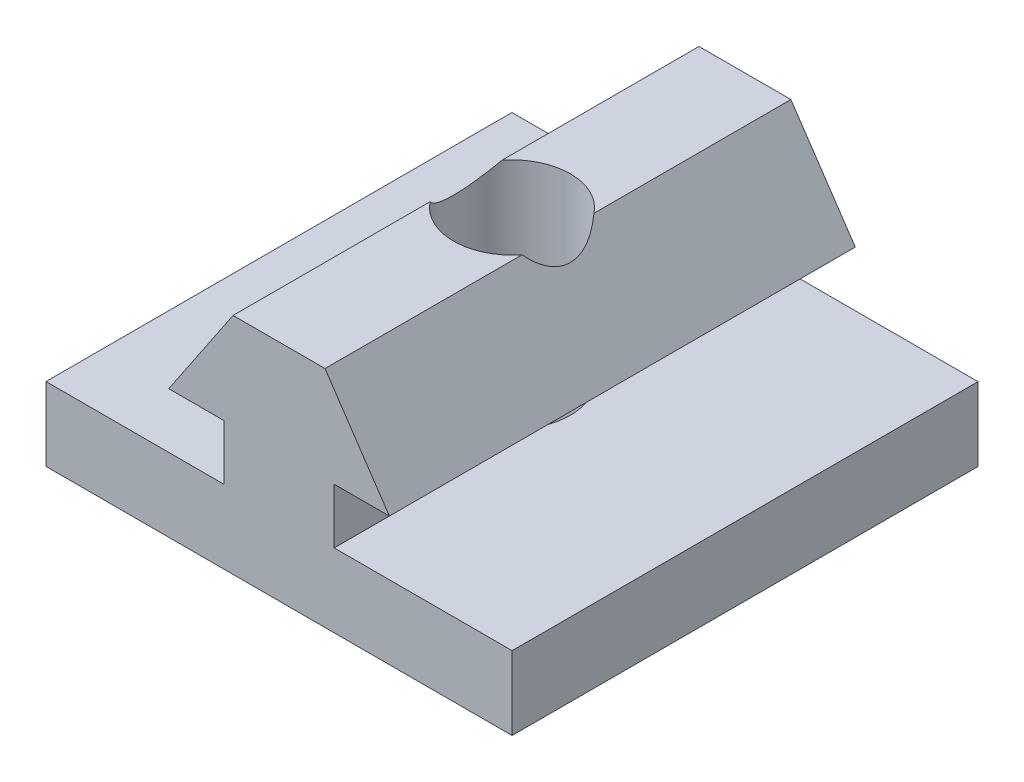
from build123d import *

# Parameters (mm, degrees)
BOSS_EXTRUDE1_DEPTH = 25.34
SKETCH2_R           = 3.175
CUT_EXTRUDE1_DEPTH  = 31.848196463


with BuildPart() as part:
    # Sketch1 → Boss-Extrude1 (new body)
    with BuildSketch(Plane.XY):
        Polygon((12.675, 0), (-12.675, 0), (-12.675, 4), (-3, 4), (-3, 7), (-6, 7), (-2.5, 12.2), (2.5, 12.2), (6, 7), (3, 7), (3, 4), (12.675, 4), align=None)
    extrude(amount=BOSS_EXTRUDE1_DEPTH)

    # Sketch2 → Cut-Extrude1 (cut, through all)
    with BuildSketch(Plane.XZ):
        with Locations(Location((0, 12.67, 0), (0, 0, 270))):
            Circle(SKETCH2_R)
    extrude(amount=-CUT_EXTRUDE1_DEPTH, mode=Mode.SUBTRACT)


solid = part.part
